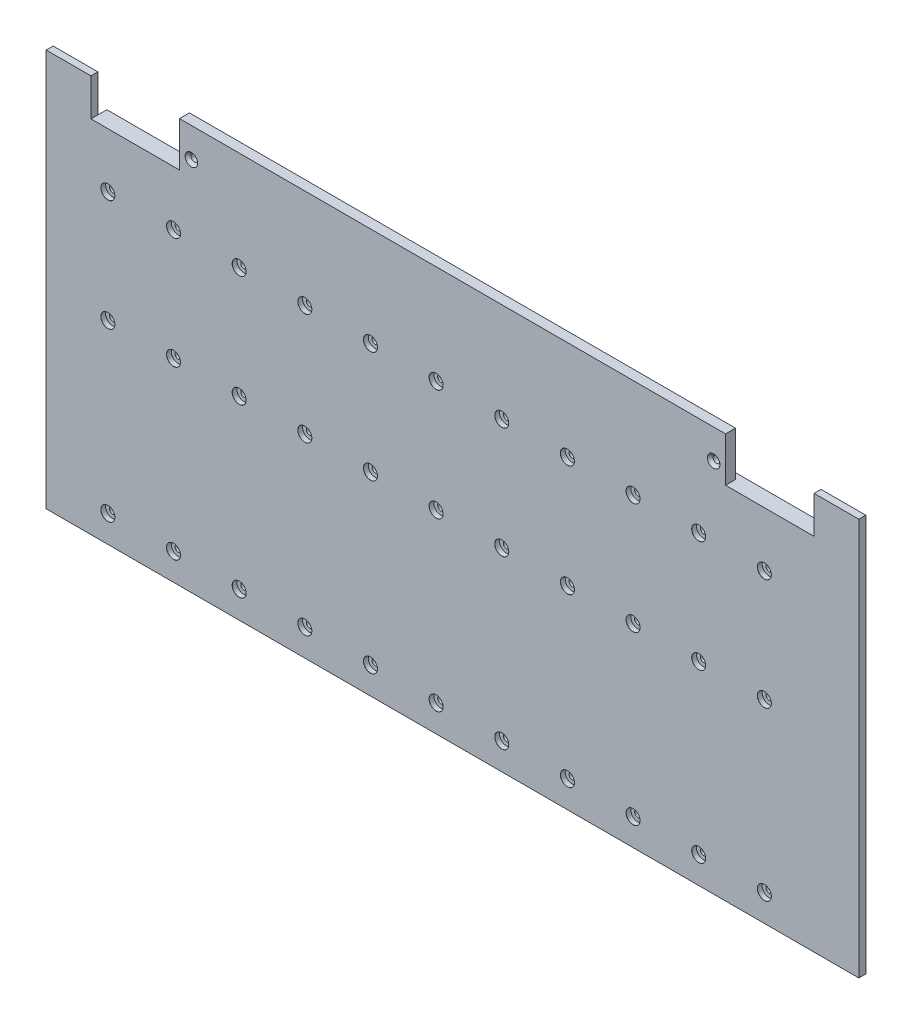
from build123d import *

# Parameters (mm, degrees)
ESQUISSE1_W                                    = 408.5
ESQUISSE1_H                                    = 181
BOSS_EXTRU_1_DEPTH                             = 8
CHAMBRAGE_POUR_VIS_T_TE_RONDE_BOMB_2_COUNT     = 2
CHAMBRAGE_POUR_VIS_T_TE_RONDE_BOMB_2_PITCH     = 56
CHAMBRAGE_POUR_VIS_T_TE_RONDE_BOMB_3_COUNT     = 2
CHAMBRAGE_POUR_VIS_T_TE_RONDE_BOMB_3_PITCH     = 140
R_P_TITION_LIN_AIRE1_COUNT                     = 11
R_P_TITION_LIN_AIRE1_PITCH                     = 33
ENL_V_MAT_EXTRU_1_REACH                        = 275.026
ESQUISSE6_W                                    = 22.5
ESQUISSE6_H                                    = 4.5
BOSS_EXTRU_2_START                             = -3.5
ESQUISSE7_W                                    = 22.5
ESQUISSE7_H                                    = 18.725
BOSS_EXTRU_2_DEPTH                             = 3.5
ESQUISSE8_W                                    = 274.5
ESQUISSE8_H                                    = 22.375
BOSS_EXTRU_3_DEPTH                             = 5
FRAISAGE_POUR_VIS_T_TE_FRAIS_E_M31_D           = 3.4
FRAISAGE_POUR_VIS_T_TE_FRAIS_E_M31_CSINK_D     = 6.3
FRAISAGE_POUR_VIS_T_TE_FRAIS_E_M31_CSINK_ANGLE = 90


with BuildPart() as part:
    # Esquisse1 → Boss.-Extru.1 (new body)
    with BuildSketch(Plane.XY):
        Rectangle(ESQUISSE1_W, ESQUISSE1_H)
    extrude(amount=BOSS_EXTRU_1_DEPTH)

    # Esquisse3 → Chambrage pour vis à tête ronde bombée M31 (revolve, cut)
    with BuildSketch(Plane(origin=(-173.25, 63, 8), x_dir=(0, -1, 0), z_dir=(1, 0, 0))):
        Polygon((0, 0), (0, 8), (1.6, 8), (1.6, 2.4), (3.5, 2.4), (3.5, 0.025), (3.525, 0), align=None)
    chambrage_pour_vis_t_te_ronde_bomb_e_m = revolve(axis=Axis((-173.25, 63, 14.35), (0, 0, -1)), mode=Mode.SUBTRACT)

    # Chambrage pour vis _ t_te ronde bomb 2: Chambrage pour vis à tête ronde bombée M31 ×2
    with Locations(*[(0, -i * CHAMBRAGE_POUR_VIS_T_TE_RONDE_BOMB_2_PITCH, 0) for i in range(1, CHAMBRAGE_POUR_VIS_T_TE_RONDE_BOMB_2_COUNT)]):
        add(chambrage_pour_vis_t_te_ronde_bomb_e_m, mode=Mode.SUBTRACT)

    # Chambrage pour vis _ t_te ronde bomb 3: Chambrage pour vis à tête ronde bombée M31 ×2
    with Locations(*[(0, -i * CHAMBRAGE_POUR_VIS_T_TE_RONDE_BOMB_3_PITCH, 0) for i in range(1, CHAMBRAGE_POUR_VIS_T_TE_RONDE_BOMB_3_COUNT)]):
        add(chambrage_pour_vis_t_te_ronde_bomb_e_m, mode=Mode.SUBTRACT)

    # Répétition linéaire1: Chambrage pour vis à tête ronde bombée M31 ×11
    with Locations(*[(i * R_P_TITION_LIN_AIRE1_PITCH, 0, 0) for i in range(1, R_P_TITION_LIN_AIRE1_COUNT)]):
        add(chambrage_pour_vis_t_te_ronde_bomb_e_m, mode=Mode.SUBTRACT)

    # Répétition linéaire1 copy 1 sketch → Répétition linéaire1 copy 1 (revolve, cut)
    with BuildSketch(Plane(origin=(-140.25, 7, 8), x_dir=(0, -1, 0), z_dir=(1, 0, 0))):
        Polygon((0, 0), (0, 8), (1.6, 8), (1.6, 2.4), (3.5, 2.4), (3.5, 0.025), (3.525, 0), align=None)
    revolve(axis=Axis((-140.25, 7, 14.35), (0, 0, -1)), mode=Mode.SUBTRACT)

    # Répétition linéaire1 copy 2 sketch → Répétition linéaire1 copy 2 (revolve, cut)
    with BuildSketch(Plane(origin=(-107.25, 7, 8), x_dir=(0, -1, 0), z_dir=(1, 0, 0))):
        Polygon((0, 0), (0, 8), (1.6, 8), (1.6, 2.4), (3.5, 2.4), (3.5, 0.025), (3.525, 0), align=None)
    revolve(axis=Axis((-107.25, 7, 14.35), (0, 0, -1)), mode=Mode.SUBTRACT)

    # Répétition linéaire1 copy 3 sketch → Répétition linéaire1 copy 3 (revolve, cut)
    with BuildSketch(Plane(origin=(-74.25, 7, 8), x_dir=(0, -1, 0), z_dir=(1, 0, 0))):
        Polygon((0, 0), (0, 8), (1.6, 8), (1.6, 2.4), (3.5, 2.4), (3.5, 0.025), (3.525, 0), align=None)
    revolve(axis=Axis((-74.25, 7, 14.35), (0, 0, -1)), mode=Mode.SUBTRACT)

    # Répétition linéaire1 copy 4 sketch → Répétition linéaire1 copy 4 (revolve, cut)
    with BuildSketch(Plane(origin=(-41.25, 7, 8), x_dir=(0, -1, 0), z_dir=(1, 0, 0))):
        Polygon((0, 0), (0, 8), (1.6, 8), (1.6, 2.4), (3.5, 2.4), (3.5, 0.025), (3.525, 0), align=None)
    revolve(axis=Axis((-41.25, 7, 14.35), (0, 0, -1)), mode=Mode.SUBTRACT)

    # Répétition linéaire1 copy 5 sketch → Répétition linéaire1 copy 5 (revolve, cut)
    with BuildSketch(Plane(origin=(-8.25, 7, 8), x_dir=(0, -1, 0), z_dir=(1, 0, 0))):
        Polygon((0, 0), (0, 8), (1.6, 8), (1.6, 2.4), (3.5, 2.4), (3.5, 0.025), (3.525, 0), align=None)
    revolve(axis=Axis((-8.25, 7, 14.35), (0, 0, -1)), mode=Mode.SUBTRACT)

    # Répétition linéaire1 copy 6 sketch → Répétition linéaire1 copy 6 (revolve, cut)
    with BuildSketch(Plane(origin=(24.75, 7, 8), x_dir=(0, -1, 0), z_dir=(1, 0, 0))):
        Polygon((0, 0), (0, 8), (1.6, 8), (1.6, 2.4), (3.5, 2.4), (3.5, 0.025), (3.525, 0), align=None)
    revolve(axis=Axis((24.75, 7, 14.35), (0, 0, -1)), mode=Mode.SUBTRACT)

    # Répétition linéaire1 copy 7 sketch → Répétition linéaire1 copy 7 (revolve, cut)
    with BuildSketch(Plane(origin=(57.75, 7, 8), x_dir=(0, -1, 0), z_dir=(1, 0, 0))):
        Polygon((0, 0), (0, 8), (1.6, 8), (1.6, 2.4), (3.5, 2.4), (3.5, 0.025), (3.525, 0), align=None)
    revolve(axis=Axis((57.75, 7, 14.35), (0, 0, -1)), mode=Mode.SUBTRACT)

    # Répétition linéaire1 copy 8 sketch → Répétition linéaire1 copy 8 (revolve, cut)
    with BuildSketch(Plane(origin=(90.75, 7, 8), x_dir=(0, -1, 0), z_dir=(1, 0, 0))):
        Polygon((0, 0), (0, 8), (1.6, 8), (1.6, 2.4), (3.5, 2.4), (3.5, 0.025), (3.525, 0), align=None)
    revolve(axis=Axis((90.75, 7, 14.35), (0, 0, -1)), mode=Mode.SUBTRACT)

    # Répétition linéaire1 copy 9 sketch → Répétition linéaire1 copy 9 (revolve, cut)
    with BuildSketch(Plane(origin=(123.75, 7, 8), x_dir=(0, -1, 0), z_dir=(1, 0, 0))):
        Polygon((0, 0), (0, 8), (1.6, 8), (1.6, 2.4), (3.5, 2.4), (3.5, 0.025), (3.525, 0), align=None)
    revolve(axis=Axis((123.75, 7, 14.35), (0, 0, -1)), mode=Mode.SUBTRACT)

    # Répétition linéaire1 copy 10 sketch → Répétition linéaire1 copy 10 (revolve, cut)
    with BuildSketch(Plane(origin=(156.75, 7, 8), x_dir=(0, -1, 0), z_dir=(1, 0, 0))):
        Polygon((0, 0), (0, 8), (1.6, 8), (1.6, 2.4), (3.5, 2.4), (3.5, 0.025), (3.525, 0), align=None)
    revolve(axis=Axis((156.75, 7, 14.35), (0, 0, -1)), mode=Mode.SUBTRACT)

    # Répétition linéaire1 copy 11 sketch → Répétition linéaire1 copy 11 (revolve, cut)
    with BuildSketch(Plane(origin=(-140.25, -77, 8), x_dir=(0, -1, 0), z_dir=(1, 0, 0))):
        Polygon((0, 0), (0, 8), (1.6, 8), (1.6, 2.4), (3.5, 2.4), (3.5, 0.025), (3.525, 0), align=None)
    revolve(axis=Axis((-140.25, -77, 14.35), (0, 0, -1)), mode=Mode.SUBTRACT)

    # Répétition linéaire1 copy 12 sketch → Répétition linéaire1 copy 12 (revolve, cut)
    with BuildSketch(Plane(origin=(-107.25, -77, 8), x_dir=(0, -1, 0), z_dir=(1, 0, 0))):
        Polygon((0, 0), (0, 8), (1.6, 8), (1.6, 2.4), (3.5, 2.4), (3.5, 0.025), (3.525, 0), align=None)
    revolve(axis=Axis((-107.25, -77, 14.35), (0, 0, -1)), mode=Mode.SUBTRACT)

    # Répétition linéaire1 copy 13 sketch → Répétition linéaire1 copy 13 (revolve, cut)
    with BuildSketch(Plane(origin=(-74.25, -77, 8), x_dir=(0, -1, 0), z_dir=(1, 0, 0))):
        Polygon((0, 0), (0, 8), (1.6, 8), (1.6, 2.4), (3.5, 2.4), (3.5, 0.025), (3.525, 0), align=None)
    revolve(axis=Axis((-74.25, -77, 14.35), (0, 0, -1)), mode=Mode.SUBTRACT)

    # Répétition linéaire1 copy 14 sketch → Répétition linéaire1 copy 14 (revolve, cut)
    with BuildSketch(Plane(origin=(-41.25, -77, 8), x_dir=(0, -1, 0), z_dir=(1, 0, 0))):
        Polygon((0, 0), (0, 8), (1.6, 8), (1.6, 2.4), (3.5, 2.4), (3.5, 0.025), (3.525, 0), align=None)
    revolve(axis=Axis((-41.25, -77, 14.35), (0, 0, -1)), mode=Mode.SUBTRACT)

    # Répétition linéaire1 copy 15 sketch → Répétition linéaire1 copy 15 (revolve, cut)
    with BuildSketch(Plane(origin=(-8.25, -77, 8), x_dir=(0, -1, 0), z_dir=(1, 0, 0))):
        Polygon((0, 0), (0, 8), (1.6, 8), (1.6, 2.4), (3.5, 2.4), (3.5, 0.025), (3.525, 0), align=None)
    revolve(axis=Axis((-8.25, -77, 14.35), (0, 0, -1)), mode=Mode.SUBTRACT)

    # Répétition linéaire1 copy 16 sketch → Répétition linéaire1 copy 16 (revolve, cut)
    with BuildSketch(Plane(origin=(24.75, -77, 8), x_dir=(0, -1, 0), z_dir=(1, 0, 0))):
        Polygon((0, 0), (0, 8), (1.6, 8), (1.6, 2.4), (3.5, 2.4), (3.5, 0.025), (3.525, 0), align=None)
    revolve(axis=Axis((24.75, -77, 14.35), (0, 0, -1)), mode=Mode.SUBTRACT)

    # Répétition linéaire1 copy 17 sketch → Répétition linéaire1 copy 17 (revolve, cut)
    with BuildSketch(Plane(origin=(57.75, -77, 8), x_dir=(0, -1, 0), z_dir=(1, 0, 0))):
        Polygon((0, 0), (0, 8), (1.6, 8), (1.6, 2.4), (3.5, 2.4), (3.5, 0.025), (3.525, 0), align=None)
    revolve(axis=Axis((57.75, -77, 14.35), (0, 0, -1)), mode=Mode.SUBTRACT)

    # Répétition linéaire1 copy 18 sketch → Répétition linéaire1 copy 18 (revolve, cut)
    with BuildSketch(Plane(origin=(90.75, -77, 8), x_dir=(0, -1, 0), z_dir=(1, 0, 0))):
        Polygon((0, 0), (0, 8), (1.6, 8), (1.6, 2.4), (3.5, 2.4), (3.5, 0.025), (3.525, 0), align=None)
    revolve(axis=Axis((90.75, -77, 14.35), (0, 0, -1)), mode=Mode.SUBTRACT)

    # Répétition linéaire1 copy 19 sketch → Répétition linéaire1 copy 19 (revolve, cut)
    with BuildSketch(Plane(origin=(123.75, -77, 8), x_dir=(0, -1, 0), z_dir=(1, 0, 0))):
        Polygon((0, 0), (0, 8), (1.6, 8), (1.6, 2.4), (3.5, 2.4), (3.5, 0.025), (3.525, 0), align=None)
    revolve(axis=Axis((123.75, -77, 14.35), (0, 0, -1)), mode=Mode.SUBTRACT)

    # Répétition linéaire1 copy 20 sketch → Répétition linéaire1 copy 20 (revolve, cut)
    with BuildSketch(Plane(origin=(156.75, -77, 8), x_dir=(0, -1, 0), z_dir=(1, 0, 0))):
        Polygon((0, 0), (0, 8), (1.6, 8), (1.6, 2.4), (3.5, 2.4), (3.5, 0.025), (3.525, 0), align=None)
    revolve(axis=Axis((156.75, -77, 14.35), (0, 0, -1)), mode=Mode.SUBTRACT)

    # Esquisse6 → Enlèv. mat.-Extru.1 (cut, up to next)
    with BuildSketch(Plane(origin=(0, 90.5, 0), x_dir=(1, 0, 0), z_dir=(0, 1, 0)), mode=Mode.PRIVATE) as enl_v_mat_extru_1_sk1:
        with Locations((-193, -2.25)):
            Rectangle(ESQUISSE6_W, ESQUISSE6_H)
    enl_v_mat_extru_1_tool1 = extrude(enl_v_mat_extru_1_sk1.sketch, amount=-ENL_V_MAT_EXTRU_1_REACH, mode=Mode.PRIVATE) & part.part
    # Esquisse6 → Enlèv. mat.-Extru.1 (cut, up to next)
    with BuildSketch(Plane(origin=(0, 90.5, 0), x_dir=(1, 0, 0), z_dir=(0, 1, 0)), mode=Mode.PRIVATE) as enl_v_mat_extru_1_sk2:
        with Locations((193, -2.25)):
            Rectangle(ESQUISSE6_W, ESQUISSE6_H)
    enl_v_mat_extru_1_tool2 = extrude(enl_v_mat_extru_1_sk2.sketch, amount=-ENL_V_MAT_EXTRU_1_REACH, mode=Mode.PRIVATE) & part.part
    add(enl_v_mat_extru_1_tool1.solids().sort_by_distance((-193, 90.5, 2.25))[0], mode=Mode.SUBTRACT)
    add(enl_v_mat_extru_1_tool2.solids().sort_by_distance((193, 90.5, 2.25))[0], mode=Mode.SUBTRACT)

    # Esquisse7 → Boss.-Extru.2 (add)
    with BuildSketch(Plane.XY.offset(8).offset(BOSS_EXTRU_2_START)):
        with Locations((-193, 99.8625)):
            Rectangle(ESQUISSE7_W, ESQUISSE7_H)
    boss_extru_2 = extrude(amount=BOSS_EXTRU_2_DEPTH)

    # Symétrie1: Boss.-Extru.2 across plane
    add(boss_extru_2.mirror(Plane(origin=(0, 0, 0), x_dir=(0, 0, 1), z_dir=(1, 0, 0))))

    # Esquisse8 → Boss.-Extru.3 (add)
    with BuildSketch(Plane.XY.offset(8)):
        with Locations((0, 101.6875)):
            Rectangle(ESQUISSE8_W, ESQUISSE8_H)
    extrude(amount=-BOSS_EXTRU_3_DEPTH)

    # Fraisage pour vis à tête fraisée M31 (through all)
    with Locations(Plane.XY.offset(8)):
        with Locations((-131.25, 98), (131.25, 98)):
            CounterSinkHole(FRAISAGE_POUR_VIS_T_TE_FRAIS_E_M31_D / 2, FRAISAGE_POUR_VIS_T_TE_FRAIS_E_M31_CSINK_D / 2, counter_sink_angle=FRAISAGE_POUR_VIS_T_TE_FRAIS_E_M31_CSINK_ANGLE)


solid = part.part
